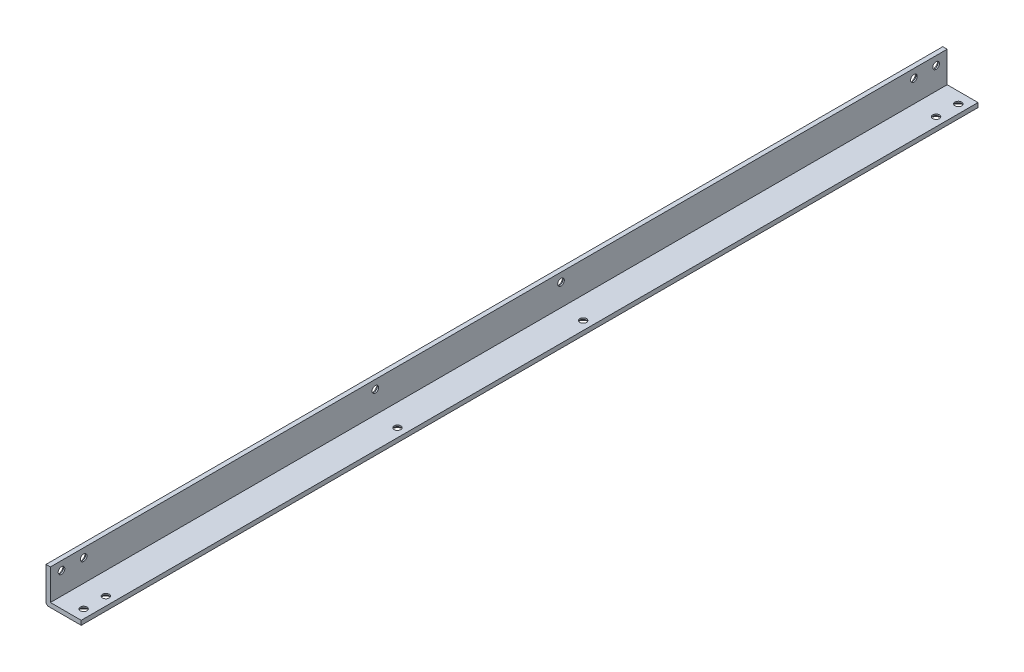
from build123d import *

# Parameters (mm, degrees)
SKETCH1_W                      = 12.7
SKETCH1_H                      = 323.5
BOSS_EXTRUDE1_DEPTH            = 1.5875
SKETCH2_W                      = 1.5875
SKETCH2_H                      = 323.5
BOSS_EXTRUDE2_DEPTH            = 11.1125
FILLET1_R                      = 1
M2_CLEARANCE_HOLE1_D           = 2.4
M2_CLEARANCE_HOLE1_DEPTH       = 2
M2_CLEARANCE_HOLE1_CSINK_D     = 4.6
M2_CLEARANCE_HOLE1_CSINK_ANGLE = 90
M2_CLEARANCE_HOLE1_TIP         = 0.721032743
M2_CLEARANCE_HOLE2_D           = 2.4
M2_CLEARANCE_HOLE2_DEPTH       = 2
M2_CLEARANCE_HOLE2_CSINK_D     = 4.6
M2_CLEARANCE_HOLE2_CSINK_ANGLE = 90
M2_CLEARANCE_HOLE2_TIP         = 0.721032743


with BuildPart() as part:
    # Sketch1 → Boss-Extrude1 (new body)
    with BuildSketch(Plane(origin=(0, 0, 0), x_dir=(1, 0, 0), z_dir=(0, 1, 0))):
        with Locations((6.35, -161.75)):
            Rectangle(SKETCH1_W, SKETCH1_H)
    extrude(amount=BOSS_EXTRUDE1_DEPTH)

    # Sketch2 → Boss-Extrude2 (add)
    with BuildSketch(Plane(origin=(0, 1.5875, 0), x_dir=(1, 0, 0), z_dir=(0, 1, 0))):
        with Locations((0.79375, -161.75)):
            Rectangle(SKETCH2_W, SKETCH2_H)
    extrude(amount=BOSS_EXTRUDE2_DEPTH)

    # Fillet1
    fillet1_edges = [part.edges().sort_by_distance(p)[0] for p in [
        (0, 0, 161.75),
    ]]
    fillet(fillet1_edges, radius=FILLET1_R)

    # M2 Clearance Hole1
    with Locations(Plane.ZY):
        with Locations((4, 9.5875), (12, 9.5875), (139.3, 9.5875), (206.3, 9.5875), (319.5, 9.5875), (311.5, 9.5875)):
            CounterSinkHole(M2_CLEARANCE_HOLE1_D / 2, M2_CLEARANCE_HOLE1_CSINK_D / 2, depth=M2_CLEARANCE_HOLE1_DEPTH, counter_sink_angle=M2_CLEARANCE_HOLE1_CSINK_ANGLE)
            with Locations((0, 0, -(M2_CLEARANCE_HOLE1_DEPTH + M2_CLEARANCE_HOLE1_TIP / 2))):  # 118° drill point
                Cone(0, M2_CLEARANCE_HOLE1_D / 2, M2_CLEARANCE_HOLE1_TIP, mode=Mode.SUBTRACT)

    # M2 Clearance Hole2
    with Locations(Plane(origin=(0, 0, 0), x_dir=(-1, 0, 0), z_dir=(0, -1, 0))):
        with Locations((-9.5875, -4), (-9.5875, -12), (-9.5875, -139.3), (-9.5875, -206.3), (-9.5875, -311.5), (-9.5875, -319.5)):
            CounterSinkHole(M2_CLEARANCE_HOLE2_D / 2, M2_CLEARANCE_HOLE2_CSINK_D / 2, depth=M2_CLEARANCE_HOLE2_DEPTH, counter_sink_angle=M2_CLEARANCE_HOLE2_CSINK_ANGLE)
            with Locations((0, 0, -(M2_CLEARANCE_HOLE2_DEPTH + M2_CLEARANCE_HOLE2_TIP / 2))):  # 118° drill point
                Cone(0, M2_CLEARANCE_HOLE2_D / 2, M2_CLEARANCE_HOLE2_TIP, mode=Mode.SUBTRACT)


solid = part.part
